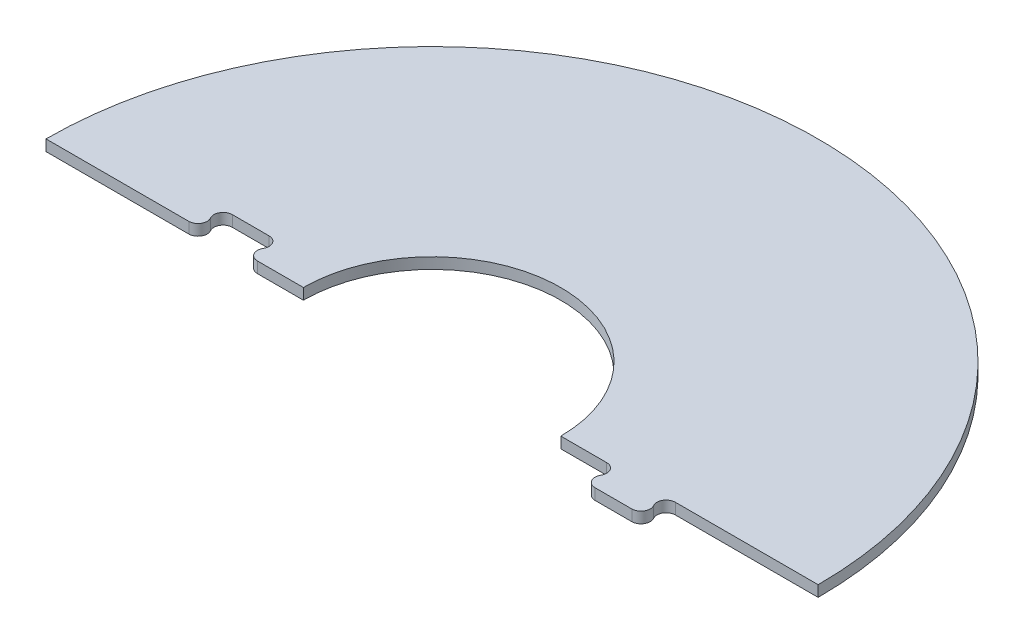
from build123d import *

# Parameters (mm, degrees)
BOSS_EXTRUDE1_DEPTH = 12


with BuildPart() as part:
    # Sketch1 → Boss-Extrude1 (new body)
    with BuildSketch(Plane(origin=(0, 0, 0), x_dir=(1, 0, 0), z_dir=(0, 1, 0))):
        with BuildLine():
            Line((-420, 0), (-264.641016151, 0))
            ThreePointArc((-264.641016151, 0), (-255.980762114, 5), (-255.980762114, 15))
            ThreePointArc((-255.980762114, 15), (-255.980762114, 25), (-247.320508076, 30))
            Line((-247.320508076, 30), (-207.320508076, 30))
            ThreePointArc((-207.320508076, 30), (-198.660254038, 25), (-198.660254038, 15))
            ThreePointArc((-198.660254038, 15), (-198.660254038, 5), (-190, 0))
            Line((-190, 0), (-140, 0))
            ThreePointArc((-140, 0), (1.07e-06, 140), (140, -2.139e-06))
            Line((140, -2.139e-06), (190, -2.149e-06))
            ThreePointArc((190, -2.149e-06), (198.660254037, -5.000002151), (198.660254035, -15.000002151))
            ThreePointArc((198.660254035, -15.000002151), (198.660254033, -25.000002151), (207.32050807, -30.000002153))
            Line((207.32050807, -30.000002153), (247.32050807, -30.000002161))
            ThreePointArc((247.32050807, -30.000002161), (255.980762108, -25.000002163), (255.98076211, -15.000002163))
            ThreePointArc((255.98076211, -15.000002163), (255.980762113, -5.000002163), (264.641016151, -2.165e-06))
            Line((264.641016151, -2.165e-06), (420, -2.196e-06))
            ThreePointArc((420, -2.196e-06), (1.098e-06, 420), (-420, 0))
        make_face()
    extrude(amount=BOSS_EXTRUDE1_DEPTH)


solid = part.part
